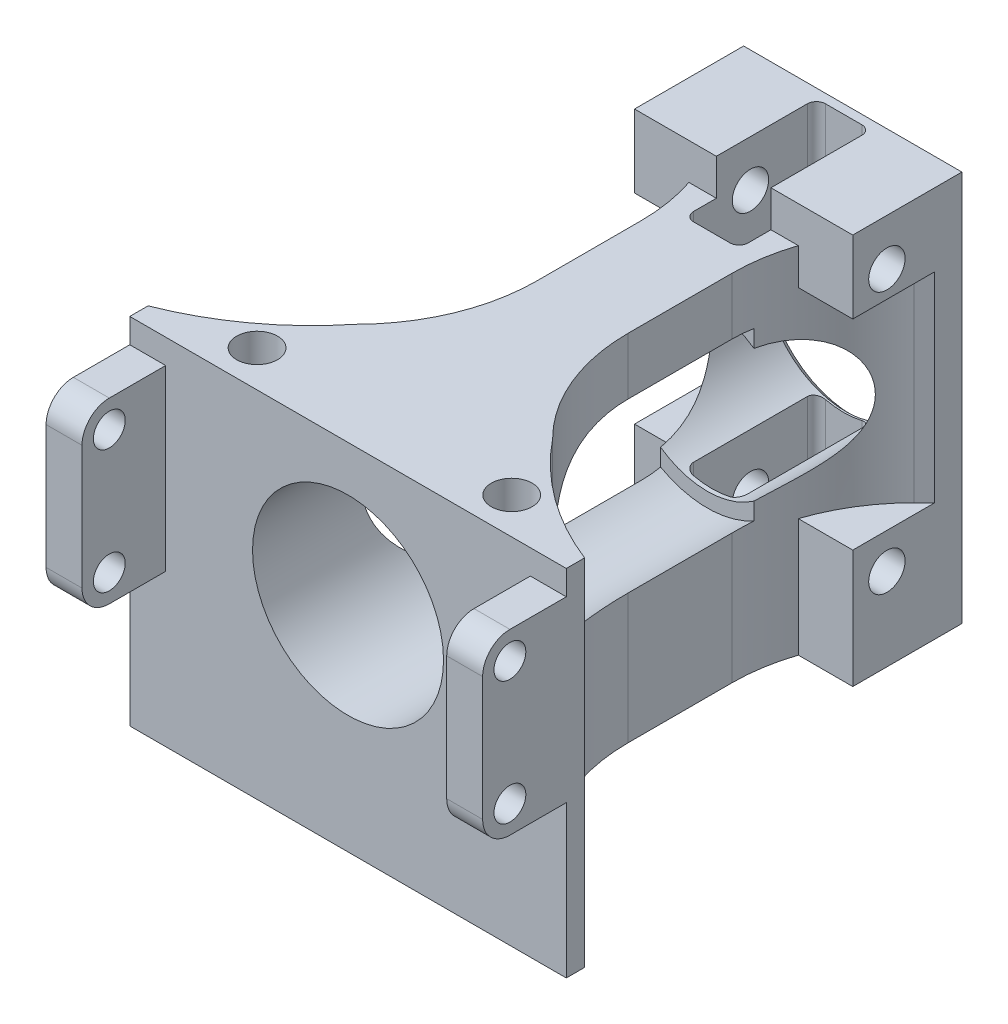
from build123d import *

# Parameters (mm, degrees)
SKETCH_1_W                = 48
SKETCH_1_H                = 31
SKETCH_1_R                = 8.9
EXTRUDE_1_DEPTH           = 65
SKETCH_2_R                = 10.5
CUT_EXTRUDE_1_DEPTH       = 49
CUT_EXTRUDE_3_DEPTH       = 76.907838857
CUT_EXTRUDE_START         = -31
CUT_EXTRUDE_5_DEPTH       = 107.907838984
SKETCH_9_R                = 1.5
CUT_EXTRUDE_6_DEPTH       = 7
CUT_EXTRUDE_START_2       = -24
SKETCH_9_2_R              = 1.5
CUT_EXTRUDE_7_DEPTH       = 7
EXTRUDE_4_DEPTH           = 8
SKETCH_11_R               = 2.25
CUT_EXTRUDE_9_DEPTH       = 80.511005658
SKETCH_14_R               = 1.5
CUT_EXTRUDE_10_DEPTH      = 11
SKETCH_15_W               = 40.1
SKETCH_15_H               = 9.5
CUT_EXTRUDE_11_DEPTH      = 80.511005658
SKETCH_17_R               = 1.75
CUT_EXTRUDE_13_DEPTH      = 85.150163426
SKETCH_19_W               = 3
SKETCH_19_H               = 3
CUT_EXTRUDE_14_DEPTH      = 76.651107105
CHAMFER_1_SIZE            = 0.8
EXTRUDE_START             = 8
SKETCH_21_R               = 1.5
EXTRUDE_6_DEPTH           = 8
EXTRUDE_START_2           = -13
EXTRUDE_7_DEPTH           = 13
EXTRUDE_8_DEPTH           = 4
EXTRUDE_8_DEPTH_BACK      = 4
CUT_EXTRUDE_15_DEPTH      = 73.899519921
CUT_EXTRUDE_15_DEPTH_BACK = 73.899519921
SKETCH_20_R               = 2


with BuildPart() as part:
    # 草图1 → 凸台-拉伸1 (new body)
    with BuildSketch(Plane.XY):
        Rectangle(SKETCH_1_W, SKETCH_1_H)
        Circle(SKETCH_1_R, mode=Mode.SUBTRACT)
    extrude(amount=EXTRUDE_1_DEPTH)

    # 草图2 → 切除-拉伸1 (cut)
    with BuildSketch(Plane.XY.offset(65)):
        Circle(SKETCH_2_R)
    extrude(amount=-CUT_EXTRUDE_1_DEPTH, mode=Mode.SUBTRACT)

    # 草图4 → 切除-拉伸3 (cut, through all)
    with BuildSketch(Plane(origin=(0, 15.5, 0), x_dir=(1, 0, 0), z_dir=(0, 1, 0))):
        with BuildLine():
            Line((-24, 9), (-10.857864376, -4.142135624))
            ThreePointArc((-10.857864376, -4.142135624), (-6.52240935, -10.6306026), (-5, -18.284271247))
            Line((-5, -18.284271247), (-5, -29.715728753))
            ThreePointArc((-5, -29.715728753), (-6.52240935, -37.3693974), (-10.857864376, -43.857864376))
            ThreePointArc((-10.857864376, -43.857864376), (-16.798925034, -49.531146093), (-24, -53.484226727))
            Line((-24, -53.484226727), (-24, 9))
        make_face()
        with BuildLine():
            Line((5, -18.284271247), (5, -29.715728753))
            ThreePointArc((5, -29.715728753), (6.52240935, -37.3693974), (10.857864376, -43.857864376))
            ThreePointArc((10.857864376, -43.857864376), (16.798925034, -49.531146093), (24, -53.484226727))
            Line((24, -53.484226727), (24, 9))
            Line((24, 9), (10.857864376, -4.142135624))
            ThreePointArc((10.857864376, -4.142135624), (6.52240935, -10.6306026), (5, -18.284271247))
        make_face()
    extrude(amount=-CUT_EXTRUDE_3_DEPTH, mode=Mode.SUBTRACT)

    # 草图6 → 切除-拉伸5 (cut, through all)
    with BuildSketch(Plane(origin=(0, 15.5, 0), x_dir=(1, 0, 0), z_dir=(0, 1, 0)).offset(CUT_EXTRUDE_START)):
        with BuildLine():
            Line((-2, -1), (2, -1))
            ThreePointArc((2, -1), (2.707106781, -1.292893219), (3, -2))
            Line((3, -2), (3, -14.5))
            ThreePointArc((3, -14.5), (2.707106781, -15.207106781), (2, -15.5))
            Line((2, -15.5), (-2, -15.5))
            ThreePointArc((-2, -15.5), (-2.707106781, -15.207106781), (-3, -14.5))
            Line((-3, -14.5), (-3, -2))
            ThreePointArc((-3, -2), (-2.707106781, -1.292893219), (-2, -1))
        make_face()
    extrude(amount=CUT_EXTRUDE_5_DEPTH, mode=Mode.SUBTRACT)

    # 草图9 → 切除-拉伸6 (cut)
    with BuildSketch(Plane(origin=(0, 15.5, 0), x_dir=(1, 0, 0), z_dir=(0, 1, 0))):
        with Locations(Location((9.5, -2.5, 0), (0, 0, 270))):
            Circle(SKETCH_9_R)
        with Locations(Location((-9.5, -2.5, 0), (0, 0, 270))):
            Circle(SKETCH_9_R)
    extrude(amount=-CUT_EXTRUDE_6_DEPTH, mode=Mode.SUBTRACT)

    # 草图9<2> → 切除-拉伸7 (cut)
    with BuildSketch(Plane(origin=(0, 15.5, 0), x_dir=(1, 0, 0), z_dir=(0, 1, 0)).offset(CUT_EXTRUDE_START_2)):
        with Locations(Location((9.5, -2.5, 0), (0, 0, 270))):
            Circle(SKETCH_9_2_R)
        with Locations(Location((-9.5, -2.5, 0), (0, 0, 270))):
            Circle(SKETCH_9_2_R)
    extrude(amount=-CUT_EXTRUDE_7_DEPTH, mode=Mode.SUBTRACT)

    # 草图12 → 凸台-拉伸4 (add)
    with BuildSketch(Plane.XZ.offset(15.5)):
        with BuildLine():
            Line((-5, 18.284271247), (5, 18.284271247))
            Line((5, 18.284271247), (5, 29.715728753))
            ThreePointArc((5, 29.715728753), (6.52240935, 37.3693974), (10.857864376, 43.857864376))
            ThreePointArc((10.857864376, 43.857864376), (16.798925034, 49.531146093), (24, 53.484226727))
            Line((24, 53.484226727), (24, 65))
            Line((24, 65), (-24, 65))
            Line((-24, 65), (-24, 53.484226727))
            ThreePointArc((-24, 53.484226727), (-16.798925034, 49.531146093), (-10.857864376, 43.857864376))
            ThreePointArc((-10.857864376, 43.857864376), (-6.52240935, 37.3693974), (-5, 29.715728753))
            Line((-5, 29.715728753), (-5, 18.284271247))
        make_face()
    extrude(amount=EXTRUDE_4_DEPTH)

    # 草图11 → 切除-拉伸9 (cut, through all)
    with BuildSketch(Plane(origin=(0, 15.5, 0), x_dir=(1, 0, 0), z_dir=(0, 1, 0))):
        with Locations(Location((14, -51.5, 0), (0, 0, 270))):
            Circle(SKETCH_11_R)
        with Locations(Location((-14, -51.5, 0), (0, 0, 270))):
            Circle(SKETCH_11_R)
    extrude(amount=-CUT_EXTRUDE_9_DEPTH, mode=Mode.SUBTRACT)

    # 草图14 → 切除-拉伸10 (cut)
    with BuildSketch(Plane.XZ.offset(23.5)):
        with Locations(Location((0, 24, 0), (0, 0, 270))):
            Circle(SKETCH_14_R)
    extrude(amount=-CUT_EXTRUDE_10_DEPTH, mode=Mode.SUBTRACT)

    # 草图15 → 切除-拉伸11 (cut, through all)
    with BuildSketch(Plane(origin=(0, 15.5, 0), x_dir=(1, 0, 0), z_dir=(0, 1, 0))):
        with Locations((0, -60.25)):
            Rectangle(SKETCH_15_W, SKETCH_15_H)
    extrude(amount=-CUT_EXTRUDE_11_DEPTH, mode=Mode.SUBTRACT)

    # 草图17 → 切除-拉伸13 (cut, through all)
    with BuildSketch(Plane(origin=(24, 0, 0), x_dir=(0, 0, -1), z_dir=(1, 0, 0))):
        with Locations((-61.7, 9.8)):
            Circle(SKETCH_17_R)
        with Locations((-61.7, -3.8)):
            Circle(SKETCH_17_R)
        with BuildLine():
            Line((-55.5, -23.5), (-55.5, -6.8))
            Line((-55.5, -6.8), (-61.7, -6.8))
            ThreePointArc((-61.7, -6.8), (-63.821320344, -5.921320344), (-64.7, -3.8))
            Line((-64.7, -3.8), (-64.7, 9.8))
            ThreePointArc((-64.7, 9.8), (-63.821320344, 11.921320344), (-61.7, 12.8))
            Line((-61.7, 12.8), (-55.5, 12.8))
            Line((-55.5, 12.8), (-55.5, 15.5))
            Line((-55.5, 15.5), (-64.7, 15.5))
            Line((-64.7, 15.5), (-94.5, 15.5))
            Line((-94.5, 15.5), (-94.5, -23.5))
            Line((-94.5, -23.5), (-55.5, -23.5))
        make_face()
    extrude(amount=-CUT_EXTRUDE_13_DEPTH, mode=Mode.SUBTRACT)

    # 草图19 → 切除-拉伸14 (cut, through all)
    with BuildSketch(Plane.XZ.offset(15.5)):
        with Locations((-13.5, 1.5)):
            Rectangle(SKETCH_19_W, SKETCH_19_H)
        with Locations((13.5, 1.5)):
            Rectangle(SKETCH_19_W, SKETCH_19_H)
    extrude(amount=-CUT_EXTRUDE_14_DEPTH, mode=Mode.SUBTRACT)

    # 倒角1
    chamfer_1_edges = [part.edges().sort_by_distance(p)[0] for p in [
        (-8.9, 0, 0),
    ]]
    chamfer(chamfer_1_edges, length=CHAMFER_1_SIZE)

    # 草图21 → 凸台-拉伸6 (add)
    with BuildSketch(Plane.XZ.offset(15.5).offset(EXTRUDE_START)):
        with BuildLine():
            Line((-10.857864376, 4.142135624), (-12, 3))
            Line((-12, 3), (-12, 0))
            Line((-12, 0), (12, 0))
            Line((12, 0), (12, 3))
            Line((12, 3), (10.857864376, 4.142135624))
            ThreePointArc((10.857864376, 4.142135624), (6.52240935, 10.6306026), (5, 18.284271247))
            Line((5, 18.284271247), (-5, 18.284271247))
            ThreePointArc((-5, 18.284271247), (-6.52240935, 10.6306026), (-10.857864376, 4.142135624))
        make_face()
        with Locations(Location((9.5, 2.5, 0), (0, 0, 90))):
            Circle(SKETCH_21_R, mode=Mode.SUBTRACT)
        with Locations(Location((-9.5, 2.5, 0), (0, 0, 90))):
            Circle(SKETCH_21_R, mode=Mode.SUBTRACT)
        with BuildLine():
            Line((2, 1), (-2, 1))
            ThreePointArc((-2, 1), (-2.707106781, 1.292893219), (-3, 2))
            Line((-3, 2), (-3, 14.5))
            ThreePointArc((-3, 14.5), (-2.707106781, 15.207106781), (-2, 15.5))
            Line((-2, 15.5), (2, 15.5))
            ThreePointArc((2, 15.5), (2.707106781, 15.207106781), (3, 14.5))
            Line((3, 14.5), (3, 2))
            ThreePointArc((3, 2), (2.707106781, 1.292893219), (2, 1))
        make_face(mode=Mode.SUBTRACT)
    extrude(amount=-EXTRUDE_6_DEPTH)

    # 草图22 → 凸台-拉伸7 (add)
    with BuildSketch(Plane.XZ.offset(23.5).offset(EXTRUDE_START_2)):
        with BuildLine():
            Line((12, 3), (12, 12))
            Line((12, 12), (6.012953497, 12))
            ThreePointArc((6.012953497, 12), (7.975835256, 7.787709202), (10.857864376, 4.142135624))
            Line((10.857864376, 4.142135624), (12, 3))
        make_face()
    extrude_7 = extrude(amount=EXTRUDE_7_DEPTH)

    # 镜向1: 凸台-拉伸7 across plane
    add(extrude_7.mirror(Plane(origin=(0, 0, 0), x_dir=(0, 0, 1), z_dir=(1, 0, 0))))

    # 草图23 → 凸台-拉伸8 (add, two sides: drawn at the far end of the back side and taken through both)
    with BuildSketch(Plane(origin=(0, 15.5, 0), x_dir=(1, 0, 0), z_dir=(0, 1, 0)).offset(-EXTRUDE_8_DEPTH_BACK)):
        with BuildLine():
            Line((-12, 0), (-12, -12))
            Line((-12, -12), (-3, -12))
            Line((-3, -12), (-3, -2))
            ThreePointArc((-3, -2), (-2.707106781, -1.292893219), (-2, -1))
            Line((-2, -1), (2, -1))
            ThreePointArc((2, -1), (2.707106781, -1.292893219), (3, -2))
            Line((3, -2), (3, -12))
            Line((3, -12), (6.012953497, -12))
            Line((6.012953497, -12), (12, -12))
            Line((12, -12), (12, 0))
            Line((12, 0), (-12, 0))
        make_face()
    extrude(amount=EXTRUDE_8_DEPTH + EXTRUDE_8_DEPTH_BACK)

    # 草图20 → 切除-拉伸15 (cut, two sides: drawn at the far end of the back side and taken through both)
    with BuildSketch(Plane(origin=(0, 0, 0), x_dir=(0, 0, -1), z_dir=(1, 0, 0)).offset(-CUT_EXTRUDE_15_DEPTH_BACK)):
        with Locations(Location((-8.25, 14.4, 0), (0, 0, 180))):
            Circle(SKETCH_20_R)
        with Locations(Location((-8.25, -14.4, 0), (0, 0, 180))):
            Circle(SKETCH_20_R)
    extrude(amount=CUT_EXTRUDE_15_DEPTH + CUT_EXTRUDE_15_DEPTH_BACK, mode=Mode.SUBTRACT)


solid = part.part
